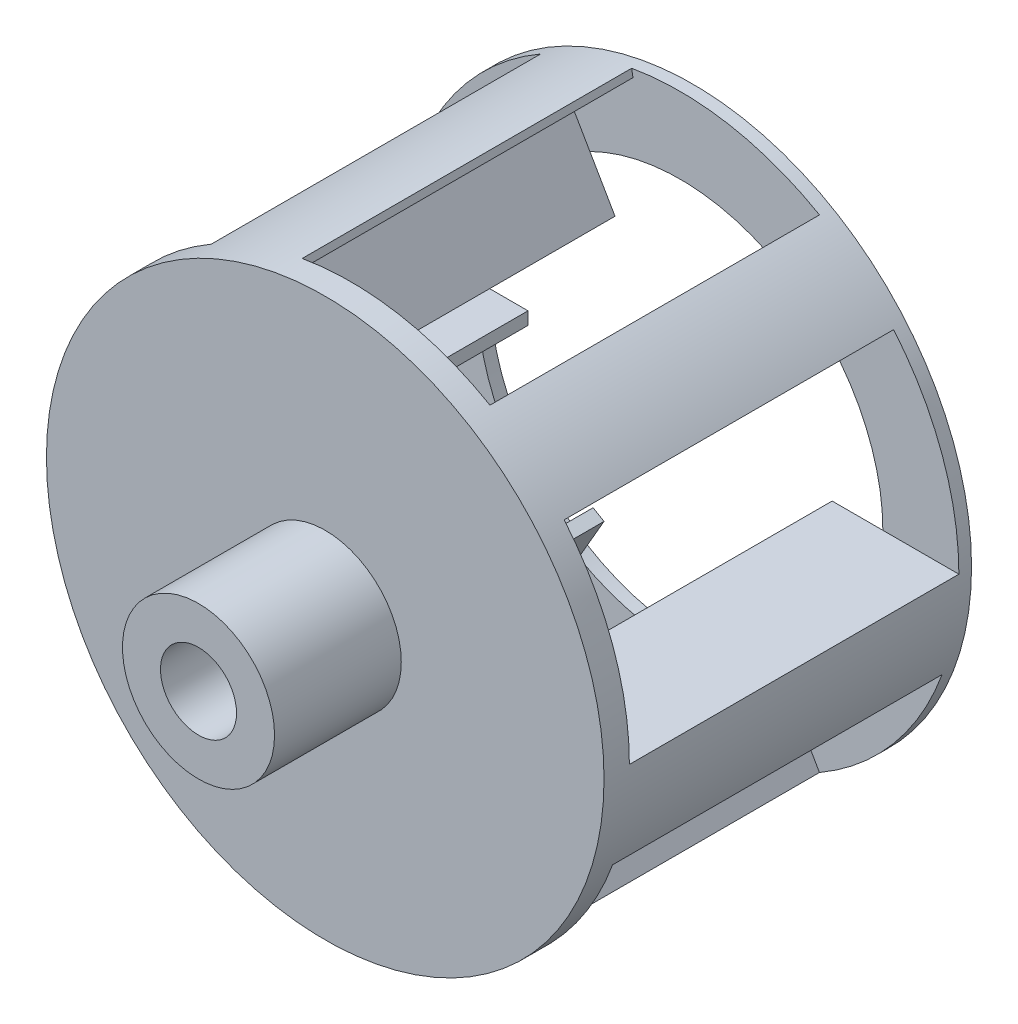
from build123d import *
from build123d.topology import SkipClean

# Parameters (mm, degrees)
SKETCH1_R           = 38.1
SKETCH1_R_2         = 19.05
BOSS_EXTRUDE1_DEPTH = 63.5
BOSS_EXTRUDE2_START = -12.7
SKETCH1_3_R         = 139.7
SKETCH1_3_R_2       = 19.05
BOSS_EXTRUDE2_DEPTH = 12.7
BOSS_EXTRUDE3_START = 165.1
BOSS_EXTRUDE3_DEPTH = 165.1
CIRPATTERN2_COUNT   = 6
BOSS_EXTRUDE4_START = 6.35
SKETCH3_R           = 139.7
SKETCH3_R_2         = 101.6
BOSS_EXTRUDE4_DEPTH = 6.35


with BuildPart() as part:
    # Sketch1 → Boss-Extrude1 (new body)
    with BuildSketch(Plane.XY):
        Circle(SKETCH1_R)
        Circle(SKETCH1_R_2, mode=Mode.SUBTRACT)
    extrude(amount=BOSS_EXTRUDE1_DEPTH)

    # Sketch1<3> → Boss-Extrude2 (add)
    with BuildSketch(Plane.XY.offset(BOSS_EXTRUDE2_START)):
        Circle(SKETCH1_3_R)
        Circle(SKETCH1_3_R_2, mode=Mode.SUBTRACT)
    extrude(amount=BOSS_EXTRUDE2_DEPTH)

    # Sketch2 → Boss-Extrude3 (add)
    with SkipClean():  # the faces are left unmerged after this step: merging them gives an invalid solid
        with BuildSketch(Plane(origin=(0, 0, -12.7), x_dir=(-1, 0, 0), z_dir=(0, 0, -1)).offset(BOSS_EXTRUDE3_START)):
            with BuildLine():
                Line((-43.599261314, 62.816135768), (-38.1, 65.991135768))
                Line((-38.1, 65.991135768), (-69.85, 120.983748909))
                ThreePointArc((-69.85, 120.983748909), (-89.797429073, 107.016408704), (-107.016408704, 89.797429073))
                Line((-107.016408704, 89.797429073), (-104.097779375, 87.34840828))
                ThreePointArc((-104.097779375, 87.34840828), (-89.757405887, 102.027938274), (-73.370038531, 114.380634489))
                Line((-73.370038531, 114.380634489), (-43.599261314, 62.816135768))
            make_face()
        boss_extrude3 = extrude(amount=-BOSS_EXTRUDE3_DEPTH)

    # CirPattern2: Boss-Extrude3 ×6 about axis
    with SkipClean():  # the faces are left unmerged after this step: merging them gives an invalid solid
        cirpattern2_axis = Axis((0, 0, -12.7), (0, 0, 1))
        for i in range(1, CIRPATTERN2_COUNT):
            add(boss_extrude3.rotate(cirpattern2_axis, i * 360 / CIRPATTERN2_COUNT))

    # Sketch3 → Boss-Extrude4 (add)
    with SkipClean():  # the faces are left unmerged after this step: merging them gives an invalid solid
        with BuildSketch(Plane(origin=(0, 0, -177.8), x_dir=(-1, 0, 0), z_dir=(0, 0, -1)).offset(BOSS_EXTRUDE4_START)):
            Circle(SKETCH3_R)
            Circle(SKETCH3_R_2, mode=Mode.SUBTRACT)
        extrude(amount=-BOSS_EXTRUDE4_DEPTH)


solid = part.part
